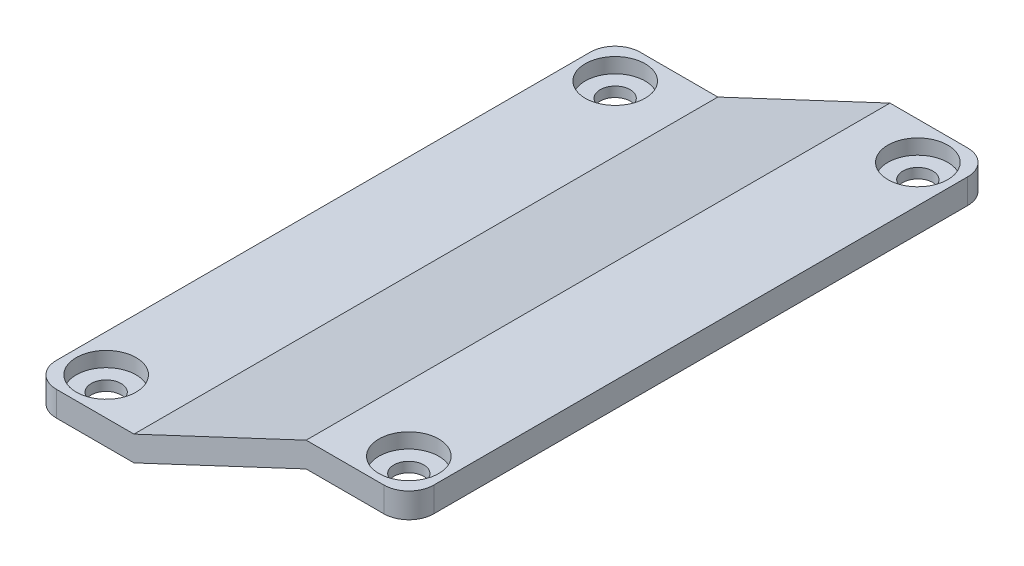
from build123d import *

# Parameters (mm, degrees)
COVER_BODY_DEPTH                        = 117
CBORE_FOR_M6_HEX_HEAD_BOLT1_D           = 6
CBORE_FOR_M6_HEX_HEAD_BOLT1_CBORE_D     = 12
CBORE_FOR_M6_HEX_HEAD_BOLT1_CBORE_DEPTH = 3
CBORE_FOR_M6_HEX_HEAD_BOLT2_D           = 6
CBORE_FOR_M6_HEX_HEAD_BOLT2_CBORE_D     = 12
CBORE_FOR_M6_HEX_HEAD_BOLT2_CBORE_DEPTH = 3
FILLET1_R                               = 5


with BuildPart() as part:
    # Sketch1 → Cover Body (new body)
    with BuildSketch(Plane.XY):
        Polygon((-17.507754177, -4.568983292), (16.992245823, 11.631016708), (37.567245823, 11.631016708), (37.567245823, 6.631016708), (16.992245823, 6.631016708), (-17.507754177, -9.568983292), (-38.082754177, -9.568983292), (-38.082754177, -4.568983292), align=None)
    extrude(amount=-COVER_BODY_DEPTH)

    # CBORE for M6 Hex Head Bolt1 (through all)
    with Locations(Plane(origin=(0, -4.568983292, 0), x_dir=(1, 0, 0), z_dir=(0, 1, 0))):
        with Locations((-30.582754177, 109.5), (-30.582754177, 7.5)):
            CounterBoreHole(CBORE_FOR_M6_HEX_HEAD_BOLT1_D / 2, CBORE_FOR_M6_HEX_HEAD_BOLT1_CBORE_D / 2, CBORE_FOR_M6_HEX_HEAD_BOLT1_CBORE_DEPTH)

    # CBORE for M6 Hex Head Bolt2 (through all)
    with Locations(Plane(origin=(0, 11.631016708, 0), x_dir=(1, 0, 0), z_dir=(0, 1, 0))):
        with Locations((30.067245823, 7.5), (30.067245823, 109.5)):
            CounterBoreHole(CBORE_FOR_M6_HEX_HEAD_BOLT2_D / 2, CBORE_FOR_M6_HEX_HEAD_BOLT2_CBORE_D / 2, CBORE_FOR_M6_HEX_HEAD_BOLT2_CBORE_DEPTH)

    # Fillet1
    fillet1_edges = [part.edges().sort_by_distance(p)[0] for p in [
        (37.567245823, 9.131016708, 0),
        (37.567245823, 9.131016708, -117),
        (-38.082754177, -7.068983292, -117),
        (-38.082754177, -7.068983292, 0),
    ]]
    fillet(fillet1_edges, radius=FILLET1_R)


solid = part.part
